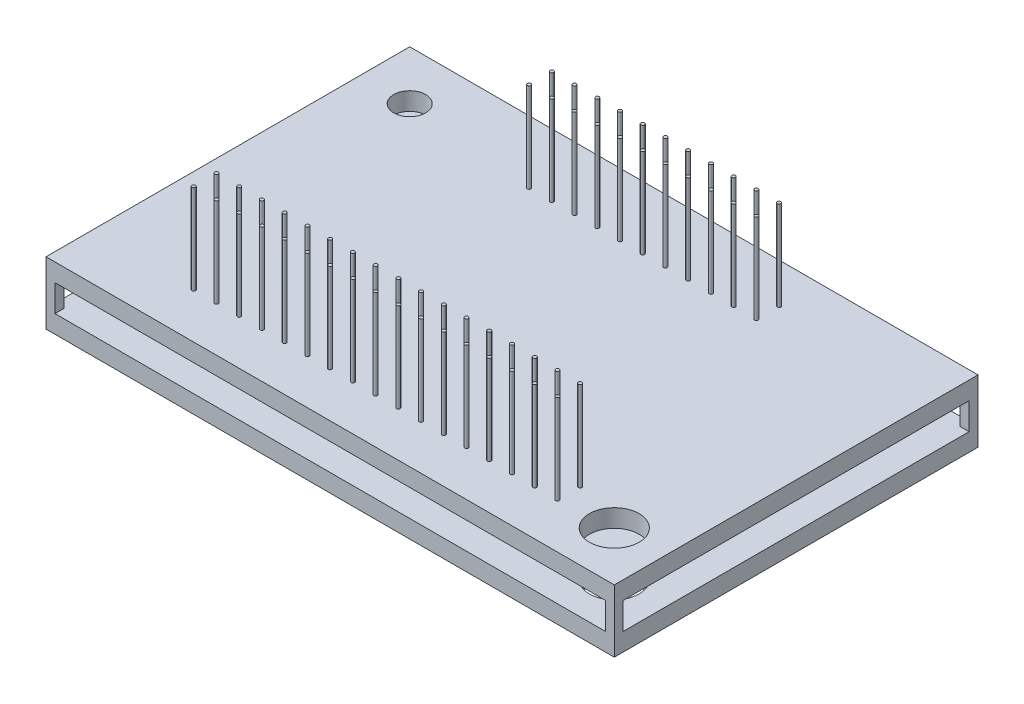
from build123d import *

# Parameters (mm, degrees)
SKETCH_1_W                        = 63.5
SKETCH_1_H                        = 40.64
EXTRUDE_1_DEPTH                   = 7
CUT_EXTRUDE_1_REACH               = 54.045
SKETCH_2_W                        = 61.5
SKETCH_2_H                        = 3
SKETCH_3_W                        = 38.64
SKETCH_3_H                        = 3
CUT_EXTRUDE_2_DEPTH               = 68.038439719
SKETCH_4_R                        = 0.2
EXTRUDE_2_DEPTH                   = 10
PATTERN_LINEAR_1_COUNT            = 2
PATTERN_LINEAR_1_PITCH            = 2.54
PATTERN_LINEAR_2_COUNT            = 17
PATTERN_LINEAR_2_PITCH            = 2.54
PATTERN_LINEAR_2_COPY_1_SKETCH_R  = 0.2
PATTERN_LINEAR_2_COPY_1_DEPTH     = 10
PATTERN_LINEAR_2_COPY_2_SKETCH_R  = 0.2
PATTERN_LINEAR_2_COPY_2_DEPTH     = 10
PATTERN_LINEAR_2_COPY_3_SKETCH_R  = 0.2
PATTERN_LINEAR_2_COPY_3_DEPTH     = 10
PATTERN_LINEAR_2_COPY_4_SKETCH_R  = 0.2
PATTERN_LINEAR_2_COPY_4_DEPTH     = 10
PATTERN_LINEAR_2_COPY_5_SKETCH_R  = 0.2
PATTERN_LINEAR_2_COPY_5_DEPTH     = 10
PATTERN_LINEAR_2_COPY_6_SKETCH_R  = 0.2
PATTERN_LINEAR_2_COPY_6_DEPTH     = 10
PATTERN_LINEAR_2_COPY_7_SKETCH_R  = 0.2
PATTERN_LINEAR_2_COPY_7_DEPTH     = 10
PATTERN_LINEAR_2_COPY_8_SKETCH_R  = 0.2
PATTERN_LINEAR_2_COPY_8_DEPTH     = 10
PATTERN_LINEAR_2_COPY_9_SKETCH_R  = 0.2
PATTERN_LINEAR_2_COPY_9_DEPTH     = 10
PATTERN_LINEAR_2_COPY_10_SKETCH_R = 0.2
PATTERN_LINEAR_2_COPY_10_DEPTH    = 10
PATTERN_LINEAR_2_COPY_11_SKETCH_R = 0.2
PATTERN_LINEAR_2_COPY_11_DEPTH    = 10
PATTERN_LINEAR_2_COPY_12_SKETCH_R = 0.2
PATTERN_LINEAR_2_COPY_12_DEPTH    = 10
PATTERN_LINEAR_2_COPY_13_SKETCH_R = 0.2
PATTERN_LINEAR_2_COPY_13_DEPTH    = 10
PATTERN_LINEAR_2_COPY_14_SKETCH_R = 0.2
PATTERN_LINEAR_2_COPY_14_DEPTH    = 10
PATTERN_LINEAR_2_COPY_15_SKETCH_R = 0.2
PATTERN_LINEAR_2_COPY_15_DEPTH    = 10
PATTERN_LINEAR_2_COPY_16_SKETCH_R = 0.2
PATTERN_LINEAR_2_COPY_16_DEPTH    = 10
SKETCH_5_R                        = 0.2
EXTRUDE_3_DEPTH                   = 10
PATTERN_LINEAR_3_COUNT            = 2
PATTERN_LINEAR_3_PITCH            = 2.54
PATTERN_LINEAR_4_COUNT            = 11
PATTERN_LINEAR_4_PITCH            = 2.54
PATTERN_LINEAR_4_COPY_1_SKETCH_R  = 0.2
PATTERN_LINEAR_4_COPY_1_DEPTH     = 10
PATTERN_LINEAR_4_COPY_2_SKETCH_R  = 0.2
PATTERN_LINEAR_4_COPY_2_DEPTH     = 10
PATTERN_LINEAR_4_COPY_3_SKETCH_R  = 0.2
PATTERN_LINEAR_4_COPY_3_DEPTH     = 10
PATTERN_LINEAR_4_COPY_4_SKETCH_R  = 0.2
PATTERN_LINEAR_4_COPY_4_DEPTH     = 10
PATTERN_LINEAR_4_COPY_5_SKETCH_R  = 0.2
PATTERN_LINEAR_4_COPY_5_DEPTH     = 10
PATTERN_LINEAR_4_COPY_6_SKETCH_R  = 0.2
PATTERN_LINEAR_4_COPY_6_DEPTH     = 10
PATTERN_LINEAR_4_COPY_7_SKETCH_R  = 0.2
PATTERN_LINEAR_4_COPY_7_DEPTH     = 10
PATTERN_LINEAR_4_COPY_8_SKETCH_R  = 0.2
PATTERN_LINEAR_4_COPY_8_DEPTH     = 10
PATTERN_LINEAR_4_COPY_9_SKETCH_R  = 0.2
PATTERN_LINEAR_4_COPY_9_DEPTH     = 10
PATTERN_LINEAR_4_COPY_10_SKETCH_R = 0.2
PATTERN_LINEAR_4_COPY_10_DEPTH    = 10
SKETCH_6_R                        = 1.782191073
SKETCH_6_R_2                      = 2.774383424
CUT_EXTRUDE_3_DEPTH               = 39.999549997
SKETCH_8_R                        = 2.5
EXTRUDE_5_DEPTH                   = 10


with BuildPart() as part:
    # 草图1 → 凸台-拉伸1 (new body)
    with BuildSketch(Plane(origin=(0, 0, 0), x_dir=(1, 0, 0), z_dir=(0, 1, 0))):
        Rectangle(SKETCH_1_W, SKETCH_1_H)
    extrude(amount=EXTRUDE_1_DEPTH)

    # 草图2 → 切除-拉伸1 (cut, up to next)
    with BuildSketch(Plane(origin=(0, 0, -20.32), x_dir=(-1, 0, 0), z_dir=(0, 0, -1)), mode=Mode.PRIVATE) as cut_extrude_1_sk1:
        with Locations((0, 3.5)):
            Rectangle(SKETCH_2_W, SKETCH_2_H)
    cut_extrude_1_tool1 = extrude(cut_extrude_1_sk1.sketch, amount=-CUT_EXTRUDE_1_REACH, mode=Mode.PRIVATE) & part.part
    add(cut_extrude_1_tool1.solids().sort_by_distance((0, 3.5, -20.32))[0], mode=Mode.SUBTRACT)

    # 草图3 → 切除-拉伸2 (cut, through all)
    with BuildSketch(Plane.ZY.offset(31.75)):
        with Locations((0, 3.5)):
            Rectangle(SKETCH_3_W, SKETCH_3_H)
    extrude(amount=-CUT_EXTRUDE_2_DEPTH, mode=Mode.SUBTRACT)

    # 草图4 → 凸台-拉伸2 (add)
    with BuildSketch(Plane(origin=(0, 7, 0), x_dir=(1, 0, 0), z_dir=(0, 1, 0))):
        with Locations(Location((-20.32, -15.24, 0), (0, 0, 90))):
            Circle(SKETCH_4_R)
    extrude_2 = extrude(amount=EXTRUDE_2_DEPTH)

    # 阵列(线性)1: 凸台-拉伸2 ×2
    with Locations(*[(0, 0, -i * PATTERN_LINEAR_1_PITCH) for i in range(1, PATTERN_LINEAR_1_COUNT)]):
        add(extrude_2)

    # 阵列(线性)2: 凸台-拉伸2 ×17
    with Locations(*[(i * PATTERN_LINEAR_2_PITCH, 0, 0) for i in range(1, PATTERN_LINEAR_2_COUNT)]):
        add(extrude_2)

    # 阵列(线性)2 copy 1 sketch → 阵列(线性)2 copy 1 (add)
    with BuildSketch(Plane(origin=(2.54, 7, -2.54), x_dir=(1, 0, 0), z_dir=(0, 1, 0))):
        with Locations(Location((-20.32, -15.24, 0), (0, 0, 90))):
            Circle(PATTERN_LINEAR_2_COPY_1_SKETCH_R)
    extrude(amount=PATTERN_LINEAR_2_COPY_1_DEPTH)

    # 阵列(线性)2 copy 2 sketch → 阵列(线性)2 copy 2 (add)
    with BuildSketch(Plane(origin=(5.08, 7, -2.54), x_dir=(1, 0, 0), z_dir=(0, 1, 0))):
        with Locations(Location((-20.32, -15.24, 0), (0, 0, 90))):
            Circle(PATTERN_LINEAR_2_COPY_2_SKETCH_R)
    extrude(amount=PATTERN_LINEAR_2_COPY_2_DEPTH)

    # 阵列(线性)2 copy 3 sketch → 阵列(线性)2 copy 3 (add)
    with BuildSketch(Plane(origin=(7.62, 7, -2.54), x_dir=(1, 0, 0), z_dir=(0, 1, 0))):
        with Locations(Location((-20.32, -15.24, 0), (0, 0, 90))):
            Circle(PATTERN_LINEAR_2_COPY_3_SKETCH_R)
    extrude(amount=PATTERN_LINEAR_2_COPY_3_DEPTH)

    # 阵列(线性)2 copy 4 sketch → 阵列(线性)2 copy 4 (add)
    with BuildSketch(Plane(origin=(10.16, 7, -2.54), x_dir=(1, 0, 0), z_dir=(0, 1, 0))):
        with Locations(Location((-20.32, -15.24, 0), (0, 0, 90))):
            Circle(PATTERN_LINEAR_2_COPY_4_SKETCH_R)
    extrude(amount=PATTERN_LINEAR_2_COPY_4_DEPTH)

    # 阵列(线性)2 copy 5 sketch → 阵列(线性)2 copy 5 (add)
    with BuildSketch(Plane(origin=(12.7, 7, -2.54), x_dir=(1, 0, 0), z_dir=(0, 1, 0))):
        with Locations(Location((-20.32, -15.24, 0), (0, 0, 90))):
            Circle(PATTERN_LINEAR_2_COPY_5_SKETCH_R)
    extrude(amount=PATTERN_LINEAR_2_COPY_5_DEPTH)

    # 阵列(线性)2 copy 6 sketch → 阵列(线性)2 copy 6 (add)
    with BuildSketch(Plane(origin=(15.24, 7, -2.54), x_dir=(1, 0, 0), z_dir=(0, 1, 0))):
        with Locations(Location((-20.32, -15.24, 0), (0, 0, 90))):
            Circle(PATTERN_LINEAR_2_COPY_6_SKETCH_R)
    extrude(amount=PATTERN_LINEAR_2_COPY_6_DEPTH)

    # 阵列(线性)2 copy 7 sketch → 阵列(线性)2 copy 7 (add)
    with BuildSketch(Plane(origin=(17.78, 7, -2.54), x_dir=(1, 0, 0), z_dir=(0, 1, 0))):
        with Locations(Location((-20.32, -15.24, 0), (0, 0, 90))):
            Circle(PATTERN_LINEAR_2_COPY_7_SKETCH_R)
    extrude(amount=PATTERN_LINEAR_2_COPY_7_DEPTH)

    # 阵列(线性)2 copy 8 sketch → 阵列(线性)2 copy 8 (add)
    with BuildSketch(Plane(origin=(20.32, 7, -2.54), x_dir=(1, 0, 0), z_dir=(0, 1, 0))):
        with Locations(Location((-20.32, -15.24, 0), (0, 0, 90))):
            Circle(PATTERN_LINEAR_2_COPY_8_SKETCH_R)
    extrude(amount=PATTERN_LINEAR_2_COPY_8_DEPTH)

    # 阵列(线性)2 copy 9 sketch → 阵列(线性)2 copy 9 (add)
    with BuildSketch(Plane(origin=(22.86, 7, -2.54), x_dir=(1, 0, 0), z_dir=(0, 1, 0))):
        with Locations(Location((-20.32, -15.24, 0), (0, 0, 90))):
            Circle(PATTERN_LINEAR_2_COPY_9_SKETCH_R)
    extrude(amount=PATTERN_LINEAR_2_COPY_9_DEPTH)

    # 阵列(线性)2 copy 10 sketch → 阵列(线性)2 copy 10 (add)
    with BuildSketch(Plane(origin=(25.4, 7, -2.54), x_dir=(1, 0, 0), z_dir=(0, 1, 0))):
        with Locations(Location((-20.32, -15.24, 0), (0, 0, 90))):
            Circle(PATTERN_LINEAR_2_COPY_10_SKETCH_R)
    extrude(amount=PATTERN_LINEAR_2_COPY_10_DEPTH)

    # 阵列(线性)2 copy 11 sketch → 阵列(线性)2 copy 11 (add)
    with BuildSketch(Plane(origin=(27.94, 7, -2.54), x_dir=(1, 0, 0), z_dir=(0, 1, 0))):
        with Locations(Location((-20.32, -15.24, 0), (0, 0, 90))):
            Circle(PATTERN_LINEAR_2_COPY_11_SKETCH_R)
    extrude(amount=PATTERN_LINEAR_2_COPY_11_DEPTH)

    # 阵列(线性)2 copy 12 sketch → 阵列(线性)2 copy 12 (add)
    with BuildSketch(Plane(origin=(30.48, 7, -2.54), x_dir=(1, 0, 0), z_dir=(0, 1, 0))):
        with Locations(Location((-20.32, -15.24, 0), (0, 0, 90))):
            Circle(PATTERN_LINEAR_2_COPY_12_SKETCH_R)
    extrude(amount=PATTERN_LINEAR_2_COPY_12_DEPTH)

    # 阵列(线性)2 copy 13 sketch → 阵列(线性)2 copy 13 (add)
    with BuildSketch(Plane(origin=(33.02, 7, -2.54), x_dir=(1, 0, 0), z_dir=(0, 1, 0))):
        with Locations(Location((-20.32, -15.24, 0), (0, 0, 90))):
            Circle(PATTERN_LINEAR_2_COPY_13_SKETCH_R)
    extrude(amount=PATTERN_LINEAR_2_COPY_13_DEPTH)

    # 阵列(线性)2 copy 14 sketch → 阵列(线性)2 copy 14 (add)
    with BuildSketch(Plane(origin=(35.56, 7, -2.54), x_dir=(1, 0, 0), z_dir=(0, 1, 0))):
        with Locations(Location((-20.32, -15.24, 0), (0, 0, 90))):
            Circle(PATTERN_LINEAR_2_COPY_14_SKETCH_R)
    extrude(amount=PATTERN_LINEAR_2_COPY_14_DEPTH)

    # 阵列(线性)2 copy 15 sketch → 阵列(线性)2 copy 15 (add)
    with BuildSketch(Plane(origin=(38.1, 7, -2.54), x_dir=(1, 0, 0), z_dir=(0, 1, 0))):
        with Locations(Location((-20.32, -15.24, 0), (0, 0, 90))):
            Circle(PATTERN_LINEAR_2_COPY_15_SKETCH_R)
    extrude(amount=PATTERN_LINEAR_2_COPY_15_DEPTH)

    # 阵列(线性)2 copy 16 sketch → 阵列(线性)2 copy 16 (add)
    with BuildSketch(Plane(origin=(40.64, 7, -2.54), x_dir=(1, 0, 0), z_dir=(0, 1, 0))):
        with Locations(Location((-20.32, -15.24, 0), (0, 0, 90))):
            Circle(PATTERN_LINEAR_2_COPY_16_SKETCH_R)
    extrude(amount=PATTERN_LINEAR_2_COPY_16_DEPTH)

    # 草图5 → 凸台-拉伸3 (add)
    with BuildSketch(Plane(origin=(0, 7, 0), x_dir=(1, 0, 0), z_dir=(0, 1, 0))):
        with Locations(Location((-11.43, 13.34, 0), (0, 0, 90))):
            Circle(SKETCH_5_R)
    extrude_3 = extrude(amount=EXTRUDE_3_DEPTH)

    # 阵列(线性)3: 凸台-拉伸3 ×2
    with Locations(*[(0, 0, -i * PATTERN_LINEAR_3_PITCH) for i in range(1, PATTERN_LINEAR_3_COUNT)]):
        add(extrude_3)

    # 阵列(线性)4: 凸台-拉伸3 ×11
    with Locations(*[(i * PATTERN_LINEAR_4_PITCH, 0, 0) for i in range(1, PATTERN_LINEAR_4_COUNT)]):
        add(extrude_3)

    # 阵列(线性)4 copy 1 sketch → 阵列(线性)4 copy 1 (add)
    with BuildSketch(Plane(origin=(2.54, 7, -2.54), x_dir=(1, 0, 0), z_dir=(0, 1, 0))):
        with Locations(Location((-11.43, 13.34, 0), (0, 0, 90))):
            Circle(PATTERN_LINEAR_4_COPY_1_SKETCH_R)
    extrude(amount=PATTERN_LINEAR_4_COPY_1_DEPTH)

    # 阵列(线性)4 copy 2 sketch → 阵列(线性)4 copy 2 (add)
    with BuildSketch(Plane(origin=(5.08, 7, -2.54), x_dir=(1, 0, 0), z_dir=(0, 1, 0))):
        with Locations(Location((-11.43, 13.34, 0), (0, 0, 90))):
            Circle(PATTERN_LINEAR_4_COPY_2_SKETCH_R)
    extrude(amount=PATTERN_LINEAR_4_COPY_2_DEPTH)

    # 阵列(线性)4 copy 3 sketch → 阵列(线性)4 copy 3 (add)
    with BuildSketch(Plane(origin=(7.62, 7, -2.54), x_dir=(1, 0, 0), z_dir=(0, 1, 0))):
        with Locations(Location((-11.43, 13.34, 0), (0, 0, 90))):
            Circle(PATTERN_LINEAR_4_COPY_3_SKETCH_R)
    extrude(amount=PATTERN_LINEAR_4_COPY_3_DEPTH)

    # 阵列(线性)4 copy 4 sketch → 阵列(线性)4 copy 4 (add)
    with BuildSketch(Plane(origin=(10.16, 7, -2.54), x_dir=(1, 0, 0), z_dir=(0, 1, 0))):
        with Locations(Location((-11.43, 13.34, 0), (0, 0, 90))):
            Circle(PATTERN_LINEAR_4_COPY_4_SKETCH_R)
    extrude(amount=PATTERN_LINEAR_4_COPY_4_DEPTH)

    # 阵列(线性)4 copy 5 sketch → 阵列(线性)4 copy 5 (add)
    with BuildSketch(Plane(origin=(12.7, 7, -2.54), x_dir=(1, 0, 0), z_dir=(0, 1, 0))):
        with Locations(Location((-11.43, 13.34, 0), (0, 0, 90))):
            Circle(PATTERN_LINEAR_4_COPY_5_SKETCH_R)
    extrude(amount=PATTERN_LINEAR_4_COPY_5_DEPTH)

    # 阵列(线性)4 copy 6 sketch → 阵列(线性)4 copy 6 (add)
    with BuildSketch(Plane(origin=(15.24, 7, -2.54), x_dir=(1, 0, 0), z_dir=(0, 1, 0))):
        with Locations(Location((-11.43, 13.34, 0), (0, 0, 90))):
            Circle(PATTERN_LINEAR_4_COPY_6_SKETCH_R)
    extrude(amount=PATTERN_LINEAR_4_COPY_6_DEPTH)

    # 阵列(线性)4 copy 7 sketch → 阵列(线性)4 copy 7 (add)
    with BuildSketch(Plane(origin=(17.78, 7, -2.54), x_dir=(1, 0, 0), z_dir=(0, 1, 0))):
        with Locations(Location((-11.43, 13.34, 0), (0, 0, 90))):
            Circle(PATTERN_LINEAR_4_COPY_7_SKETCH_R)
    extrude(amount=PATTERN_LINEAR_4_COPY_7_DEPTH)

    # 阵列(线性)4 copy 8 sketch → 阵列(线性)4 copy 8 (add)
    with BuildSketch(Plane(origin=(20.32, 7, -2.54), x_dir=(1, 0, 0), z_dir=(0, 1, 0))):
        with Locations(Location((-11.43, 13.34, 0), (0, 0, 90))):
            Circle(PATTERN_LINEAR_4_COPY_8_SKETCH_R)
    extrude(amount=PATTERN_LINEAR_4_COPY_8_DEPTH)

    # 阵列(线性)4 copy 9 sketch → 阵列(线性)4 copy 9 (add)
    with BuildSketch(Plane(origin=(22.86, 7, -2.54), x_dir=(1, 0, 0), z_dir=(0, 1, 0))):
        with Locations(Location((-11.43, 13.34, 0), (0, 0, 90))):
            Circle(PATTERN_LINEAR_4_COPY_9_SKETCH_R)
    extrude(amount=PATTERN_LINEAR_4_COPY_9_DEPTH)

    # 阵列(线性)4 copy 10 sketch → 阵列(线性)4 copy 10 (add)
    with BuildSketch(Plane(origin=(25.4, 7, -2.54), x_dir=(1, 0, 0), z_dir=(0, 1, 0))):
        with Locations(Location((-11.43, 13.34, 0), (0, 0, 90))):
            Circle(PATTERN_LINEAR_4_COPY_10_SKETCH_R)
    extrude(amount=PATTERN_LINEAR_4_COPY_10_DEPTH)

    # 草图6 → 切除-拉伸3 (cut, through all)
    with BuildSketch(Plane(origin=(0, 7, 0), x_dir=(1, 0, 0), z_dir=(0, 1, 0))):
        with Locations(Location((-26.24, 14.81, 0), (0, 0, 270))):
            Circle(SKETCH_6_R)
        with Locations(Location((26.24, -14.81, 0), (0, 0, 270))):
            Circle(SKETCH_6_R_2)
    extrude(amount=-CUT_EXTRUDE_3_DEPTH, mode=Mode.SUBTRACT)

    # 草图8 → 凸台-拉伸5 (add)
    with BuildSketch(Plane(origin=(0, 0, 0), x_dir=(-1, 0, 0), z_dir=(0, -1, 0))):
        with Locations(Location((-0.766228361, 13.516236926, 0), (0, 0, 90))):
            Circle(SKETCH_8_R)
    extrude(amount=EXTRUDE_5_DEPTH)


solid = part.part
